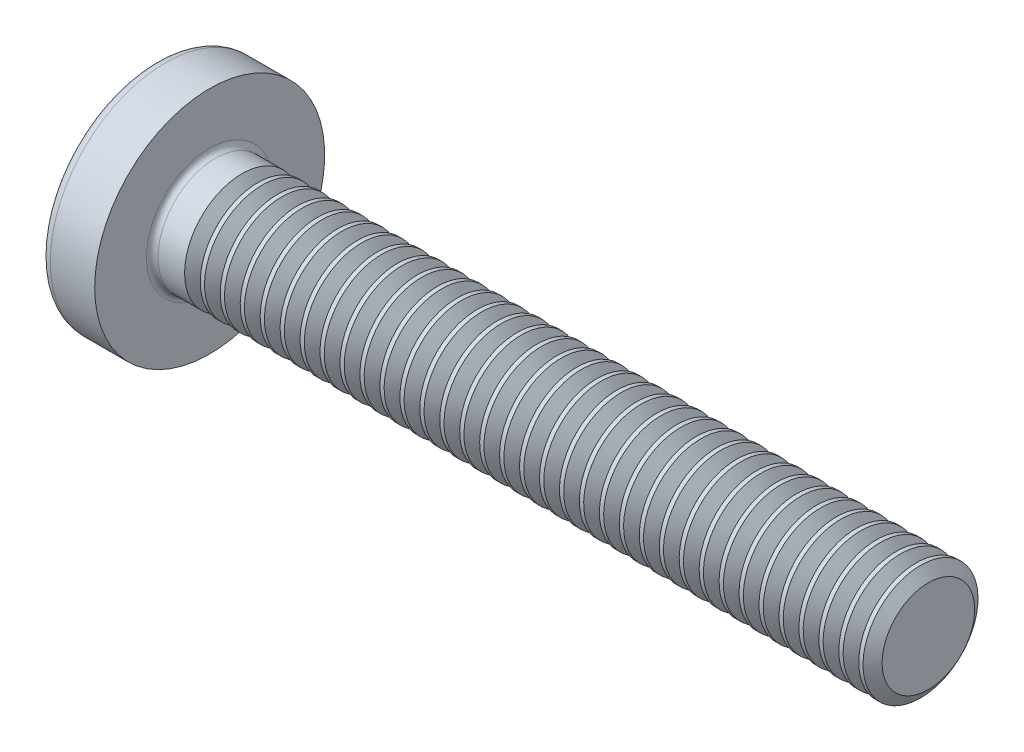
from build123d import *

# Parameters (mm, degrees)
FILLET1_R       = 0.2
RECPAT_COUNT    = 2
RECPAT_ANGLE    = 90
THDSCHPAT_COUNT = 35
THDSCHPAT_PITCH = 0.694117647


with BuildPart() as part:
    # BodySke → Base-Revolve (revolve)
    with BuildSketch(Plane.XY, mode=Mode.PRIVATE) as base_revolve_sk:
        with BuildLine():
            Line((3.1, 2), (3.1, 4))
            Line((3.1, 4), (1.555305874, 4))
            ThreePointArc((1.555305874, 4), (1.392873227, 3.961271902), (1.265388955, 3.853420195))
            ThreePointArc((1.265388955, 3.853420195), (0.324444487, 2.027933456), (0, 0))
            Line((0, 0), (28.1, 0))
            Line((28.1, 0), (28.1, 2))
            Line((28.1, 2), (3.1, 2))
        make_face()
    revolve(base_revolve_sk.sketch.rotate(Axis((1.555305874, 0, 0), (1, 0, 0)), 90), axis=Axis((1.555305874, 0, 0), (1, 0, 0)))

    # Fillet1
    fillet1_edges = [part.edges().sort_by_distance(p)[0] for p in [
        (3.1, 0, -2),
    ]]
    fillet(fillet1_edges, radius=FILLET1_R)

    # Sketch3 → Recess section 0
    with BuildSketch(Plane(origin=(0, 0, 0), x_dir=(0, 0, -1), z_dir=(1, 0, 0))):
        with BuildLine():
            Line((0.515, -2.15), (-0.515, -2.15))
            Line((-0.515, -2.15), (-0.515, 2.15))
            Line((-0.515, 2.15), (0.515, 2.15))
            Line((0.515, 2.15), (0.515, -2.15))
        make_face()
    # Sketch4 → Recess section 1
    with BuildSketch(Plane(origin=(2.34, 0, 0), x_dir=(0, 0, -1), z_dir=(1, 0, 0))):
        with BuildLine():
            Line((0.515, -0.983319232), (-0.515, -0.983319232))
            Line((-0.515, -0.983319232), (-0.515, 0.983319232))
            Line((-0.515, 0.983319232), (0.515, 0.983319232))
            Line((0.515, 0.983319232), (0.515, -0.983319232))
        make_face()
    recess = loft(mode=Mode.SUBTRACT)

    # RecPat: Recess ×2 about axis
    recpat_axis = Axis((0, 0, 0), (1, 0, 0))
    for i in range(1, RECPAT_COUNT):
        add(recess.rotate(recpat_axis, i * RECPAT_ANGLE / (RECPAT_COUNT - 1)), mode=Mode.SUBTRACT)

    # RecCorSke → RecessCore (revolve, cut)
    with BuildSketch(Plane.XY, mode=Mode.PRIVATE) as recesscore_sk:
        Polygon((0, 0), (0, 1.01462874), (2.34, 0.851), (2.616506661, 0), align=None)
    revolve(recesscore_sk.sketch.rotate(Axis((-3.175, 0, 0), (1, 0, 0)), 14.547591759), axis=Axis((-3.175, 0, 0), (1, 0, 0)), mode=Mode.SUBTRACT)

    # ThdSchSke → ThreadSchematic (revolve, cut)
    with BuildSketch(Plane.XY, mode=Mode.PRIVATE) as threadschematic_sk:
        Polygon((4.5, -1.61), (4.22691906, -2), (4.22691906, -2.5), (4.77308094, -2.5), (4.77308094, -2), align=None)
    threadschematic = revolve(threadschematic_sk.sketch.rotate(Axis((-3.175, 0, 0), (1, 0, 0)), 270), axis=Axis((-3.175, 0, 0), (1, 0, 0)), mode=Mode.SUBTRACT)

    # ThdSchPat: ThreadSchematic ×35
    with Locations(*[(i * THDSCHPAT_PITCH, 0, 0) for i in range(1, THDSCHPAT_COUNT)]):
        add(threadschematic, mode=Mode.SUBTRACT)


solid = part.part
